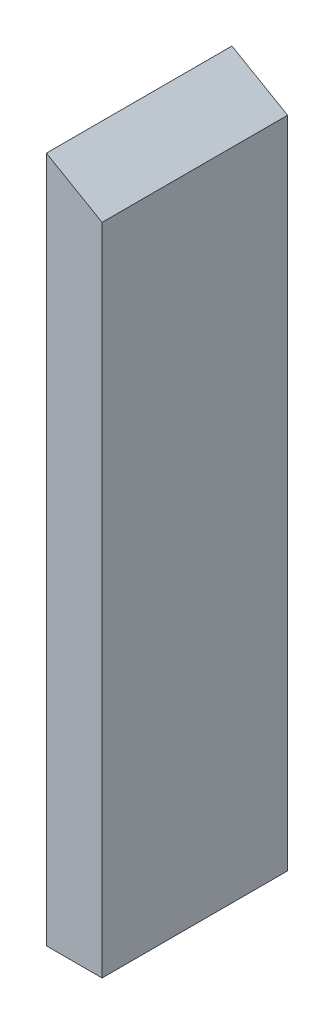
from build123d import *

# Parameters (mm, degrees)
BOSS_EXTRUDE1_DEPTH = 10


with BuildPart() as part:
    # Sketch1 → Boss-Extrude1 (new body)
    with BuildSketch(Plane.XY):
        Polygon((-19.436056893, 59.579396178), (-16.436056893, 57.84734537), (-16.436056893, 22.579396178), (-19.436056893, 22.579396178), align=None)
    extrude(amount=BOSS_EXTRUDE1_DEPTH)


solid = part.part
